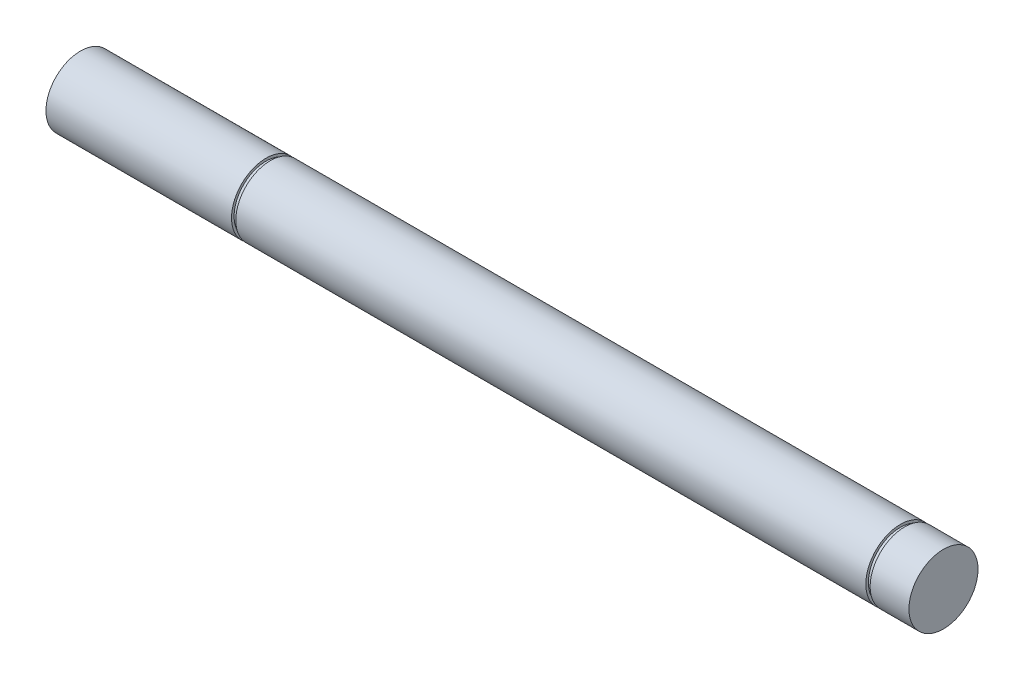
from build123d import *

# Parameters (mm, degrees)
SKETCH1_R           = 4
BOSS_EXTRUDE1_DEPTH = 50
SKETCH2_W           = 0.5
SKETCH2_H           = 0.3
SKETCH3_W           = 0.5
SKETCH3_H           = 0.3


with BuildPart() as part:
    # Sketch1 → Boss-Extrude1 (new, symmetric)
    with BuildSketch(Plane(origin=(0, 0, 0), x_dir=(0, 0, -1), z_dir=(1, 0, 0))):
        Circle(SKETCH1_R)
    extrude(amount=BOSS_EXTRUDE1_DEPTH, both=True)

    # Sketch2 → Cut-Revolve1 (revolve, cut)
    with BuildSketch(Plane.XY, mode=Mode.PRIVATE) as cut_revolve1_sk:
        with Locations((45.25, 3.85)):
            Rectangle(SKETCH2_W, SKETCH2_H)
    revolve(cut_revolve1_sk.sketch.rotate(Axis((0, 0, 0), (1, 0, 0)), 90), axis=Axis((0, 0, 0), (1, 0, 0)), mode=Mode.SUBTRACT)

    # Sketch3 → Cut-Revolve2 (revolve, cut)
    with BuildSketch(Plane.XY, mode=Mode.PRIVATE) as cut_revolve2_sk:
        with Locations((-28.25, 3.85)):
            Rectangle(SKETCH3_W, SKETCH3_H)
    revolve(cut_revolve2_sk.sketch.rotate(Axis((0, 0, 0), (-1, 0, 0)), 270), axis=Axis((0, 0, 0), (-1, 0, 0)), mode=Mode.SUBTRACT)


solid = part.part
